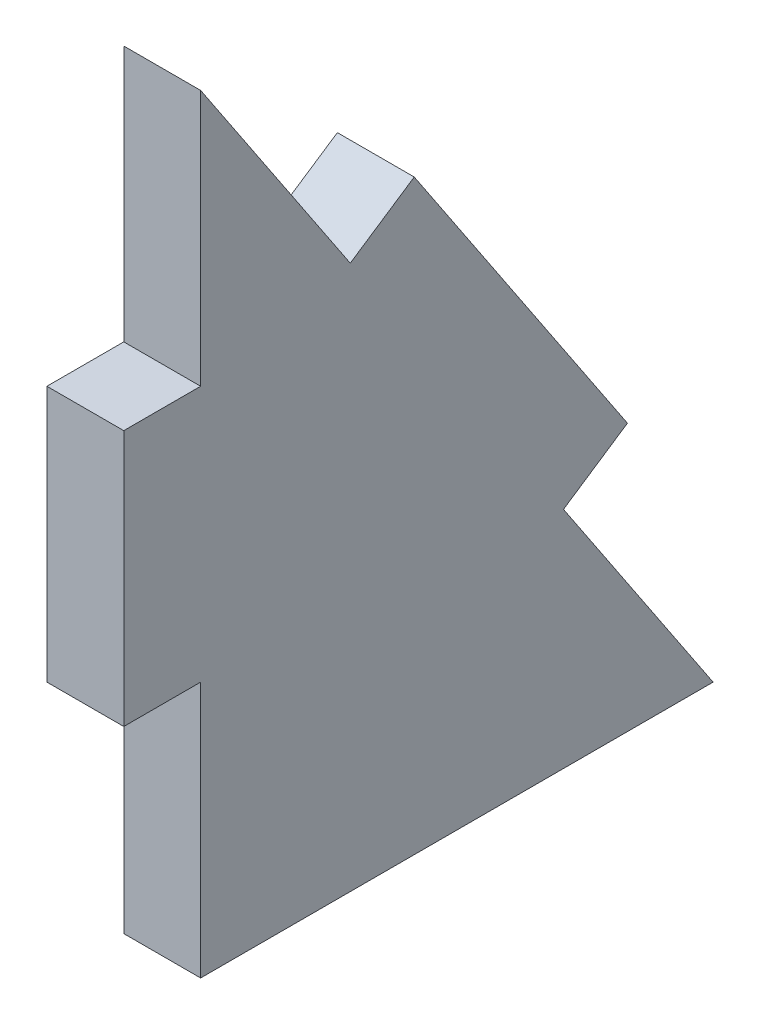
from build123d import *

# Parameters (mm, degrees)
BOSS_EXTRUDE1_DEPTH = 3


with BuildPart() as part:
    # Sketch1 → Boss-Extrude1 (new body)
    with BuildSketch(Plane(origin=(0, 0, 0), x_dir=(0, 0, -1), z_dir=(1, 0, 0))):
        Polygon((0, 30), (5.839748528, 21.240377208), (8.335899411, 22.904477796), (16.656402355, 10.423723381), (14.160251472, 8.759622792), (20, 0), (0, 0), (0, 10), (-3, 10), (-3, 20), (0, 20), align=None)
    extrude(amount=BOSS_EXTRUDE1_DEPTH)


solid = part.part
